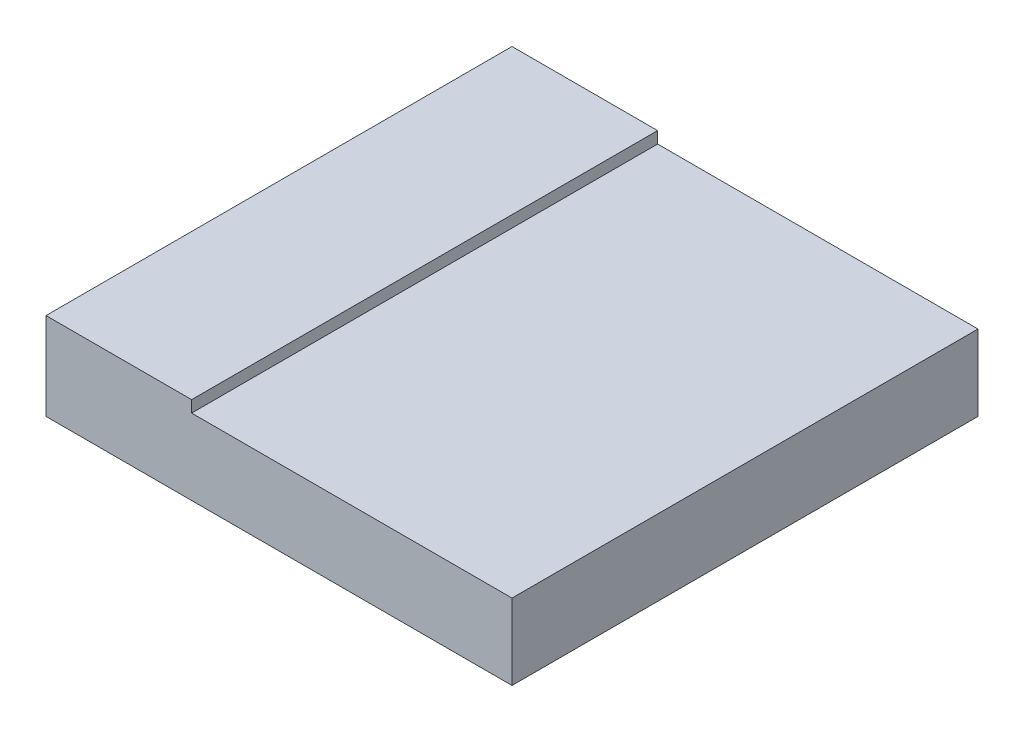
from build123d import *

# Parameters (mm, degrees)
SKETCH1_W           = 101.6
SKETCH1_H           = 101.6
BOSS_EXTRUDE1_DEPTH = 19.05
SKETCH2_W           = 69.85
SKETCH2_H           = 101.6
CUT_EXTRUDE1_DEPTH  = 2.54


with BuildPart() as part:
    # Sketch1 → Boss-Extrude1 (new body)
    with BuildSketch(Plane(origin=(0, 0, 0), x_dir=(1, 0, 0), z_dir=(0, 1, 0))):
        with Locations((50.8, 50.8)):
            Rectangle(SKETCH1_W, SKETCH1_H)
    extrude(amount=BOSS_EXTRUDE1_DEPTH)

    # Sketch2 → Cut-Extrude1 (cut)
    with BuildSketch(Plane(origin=(0, 19.05, 0), x_dir=(1, 0, 0), z_dir=(0, 1, 0))):
        with Locations((66.675, 50.8)):
            Rectangle(SKETCH2_W, SKETCH2_H)
    extrude(amount=-CUT_EXTRUDE1_DEPTH, mode=Mode.SUBTRACT)


solid = part.part
